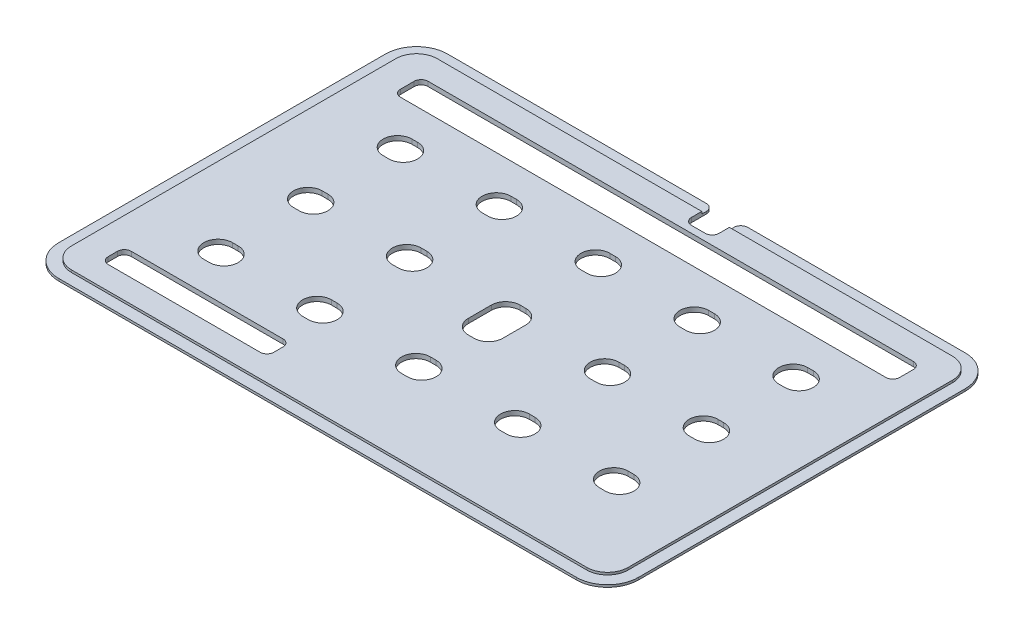
from build123d import *

# Parameters (mm, degrees)
SKETCH1_W                = 252
SKETCH1_H                = 169
OUTER_PROFILE_DEPTH      = 1
SKETCH2_W                = 242
SKETCH2_H                = 159
INNER_PROFILE_DEPTH      = 1
FILLET1_R                = 9
FILLET2_R                = 13.5
CUTOUT_DEPTH             = 152.724256465
CUTOUTS_COUNT            = 3
CUTOUTS_PITCH            = 43
CUTOUTS_COUNT_DIR2       = 3
CUTOUTS_PITCH_DIR2       = 39
MIRROR1_COPY_1_DEPTH     = 152.724256465
MIRROR1_COPY_2_DEPTH     = 152.724256465
MIRROR1_COPY_3_DEPTH     = 152.724256465
MIRROR1_COPY_4_DEPTH     = 152.724256465
MIRROR1_COPY_5_DEPTH     = 152.724256465
MIRROR1_COPY_6_DEPTH     = 152.724256465
MIRROR1_COPY_7_DEPTH     = 152.724256465
MIRROR1_COPY_8_DEPTH     = 152.724256465
MIRROR1_COPY_9_DEPTH     = 152.724256465
SKETCH4_W                = 217
SKETCH4_H                = 12
MESSAGE_WINDOW_DEPTH     = 152.724256465
MESSAGE_WINDOW_CORNERS_R = 3
SKETCH5_W                = 12
SKETCH5_H                = 12.5
CAMERA_CUTOUT_DEPTH      = 152.724256465
FILLET3_R                = 3
CUT_EXTRUDE1_DEPTH       = 152.724256465
CUT_EXTRUDE1_DEPTH_BACK  = 152.724256465
SKETCH7_W                = 72
SKETCH7_H                = 10
CUT_EXTRUDE2_DEPTH       = 10
FILLET5_R                = 3


with BuildPart() as part:
    # Sketch1 → Outer Profile (new body)
    with BuildSketch(Plane(origin=(0, 0, 0), x_dir=(1, 0, 0), z_dir=(0, 1, 0))):
        Rectangle(SKETCH1_W, SKETCH1_H)
    extrude(amount=OUTER_PROFILE_DEPTH)

    # Sketch2 → Inner Profile (add)
    with BuildSketch(Plane(origin=(0, 1, 0), x_dir=(1, 0, 0), z_dir=(0, 1, 0))):
        Rectangle(SKETCH2_W, SKETCH2_H)
    extrude(amount=INNER_PROFILE_DEPTH)

    # Fillet1
    fillet1_edges = [part.edges().sort_by_distance(p)[0] for p in [
        (121, 1.5, 79.5),
        (121, 1.5, -79.5),
        (-121, 1.5, -79.5),
        (-121, 1.5, 79.5),
    ]]
    fillet(fillet1_edges, radius=FILLET1_R)

    # Fillet2
    fillet2_edges = [part.edges().sort_by_distance(p)[0] for p in [
        (126, 0.5, 84.5),
        (-126, 0.5, 84.5),
        (-126, 0.5, -84.5),
        (126, 0.5, -84.5),
    ]]
    fillet(fillet2_edges, radius=FILLET2_R)

    # Sketch3 → Cutout (cut, through all)
    with BuildSketch(Plane(origin=(0, 2, 0), x_dir=(1, 0, 0), z_dir=(0, 1, 0))):
        with BuildLine():
            Line((-1.25, -34.25), (1.25, -34.25))
            ThreePointArc((1.25, -34.25), (7.5, -40.5), (1.25, -46.75))
            Line((1.25, -46.75), (-1.25, -46.75))
            ThreePointArc((-1.25, -46.75), (-7.5, -40.5), (-1.25, -34.25))
        make_face()
    cutout = extrude(amount=-CUTOUT_DEPTH, mode=Mode.SUBTRACT)

    # Cutouts: Cutout 3 × 3
    with Locations(*[(-i * CUTOUTS_PITCH, 0, -j * CUTOUTS_PITCH_DIR2) for i in range(CUTOUTS_COUNT) for j in range(CUTOUTS_COUNT_DIR2) if (i, j) != (0, 0)]):
        add(cutout, mode=Mode.SUBTRACT)

    # Mirror1 copy 1 sketch → Mirror1 copy 1 (cut, through all)
    with BuildSketch(Plane(origin=(0, 2, -39), x_dir=(-1, 0, 0), z_dir=(0, 1, 0))):
        with BuildLine():
            Line((-1.25, 34.25), (1.25, 34.25))
            ThreePointArc((1.25, 34.25), (7.5, 40.5), (1.25, 46.75))
            Line((1.25, 46.75), (-1.25, 46.75))
            ThreePointArc((-1.25, 46.75), (-7.5, 40.5), (-1.25, 34.25))
        make_face()
    extrude(amount=-MIRROR1_COPY_1_DEPTH, mode=Mode.SUBTRACT)

    # Mirror1 copy 2 sketch → Mirror1 copy 2 (cut, through all)
    with BuildSketch(Plane(origin=(0, 2, -78), x_dir=(-1, 0, 0), z_dir=(0, 1, 0))):
        with BuildLine():
            Line((-1.25, 34.25), (1.25, 34.25))
            ThreePointArc((1.25, 34.25), (7.5, 40.5), (1.25, 46.75))
            Line((1.25, 46.75), (-1.25, 46.75))
            ThreePointArc((-1.25, 46.75), (-7.5, 40.5), (-1.25, 34.25))
        make_face()
    extrude(amount=-MIRROR1_COPY_2_DEPTH, mode=Mode.SUBTRACT)

    # Mirror1 copy 3 sketch → Mirror1 copy 3 (cut, through all)
    with BuildSketch(Plane(origin=(43, 2, 0), x_dir=(-1, 0, 0), z_dir=(0, 1, 0))):
        with BuildLine():
            Line((-1.25, 34.25), (1.25, 34.25))
            ThreePointArc((1.25, 34.25), (7.5, 40.5), (1.25, 46.75))
            Line((1.25, 46.75), (-1.25, 46.75))
            ThreePointArc((-1.25, 46.75), (-7.5, 40.5), (-1.25, 34.25))
        make_face()
    extrude(amount=-MIRROR1_COPY_3_DEPTH, mode=Mode.SUBTRACT)

    # Mirror1 copy 4 sketch → Mirror1 copy 4 (cut, through all)
    with BuildSketch(Plane(origin=(43, 2, -39), x_dir=(-1, 0, 0), z_dir=(0, 1, 0))):
        with BuildLine():
            Line((-1.25, 34.25), (1.25, 34.25))
            ThreePointArc((1.25, 34.25), (7.5, 40.5), (1.25, 46.75))
            Line((1.25, 46.75), (-1.25, 46.75))
            ThreePointArc((-1.25, 46.75), (-7.5, 40.5), (-1.25, 34.25))
        make_face()
    extrude(amount=-MIRROR1_COPY_4_DEPTH, mode=Mode.SUBTRACT)

    # Mirror1 copy 5 sketch → Mirror1 copy 5 (cut, through all)
    with BuildSketch(Plane(origin=(43, 2, -78), x_dir=(-1, 0, 0), z_dir=(0, 1, 0))):
        with BuildLine():
            Line((-1.25, 34.25), (1.25, 34.25))
            ThreePointArc((1.25, 34.25), (7.5, 40.5), (1.25, 46.75))
            Line((1.25, 46.75), (-1.25, 46.75))
            ThreePointArc((-1.25, 46.75), (-7.5, 40.5), (-1.25, 34.25))
        make_face()
    extrude(amount=-MIRROR1_COPY_5_DEPTH, mode=Mode.SUBTRACT)

    # Mirror1 copy 6 sketch → Mirror1 copy 6 (cut, through all)
    with BuildSketch(Plane(origin=(86, 2, 0), x_dir=(-1, 0, 0), z_dir=(0, 1, 0))):
        with BuildLine():
            Line((-1.25, 34.25), (1.25, 34.25))
            ThreePointArc((1.25, 34.25), (7.5, 40.5), (1.25, 46.75))
            Line((1.25, 46.75), (-1.25, 46.75))
            ThreePointArc((-1.25, 46.75), (-7.5, 40.5), (-1.25, 34.25))
        make_face()
    extrude(amount=-MIRROR1_COPY_6_DEPTH, mode=Mode.SUBTRACT)

    # Mirror1 copy 7 sketch → Mirror1 copy 7 (cut, through all)
    with BuildSketch(Plane(origin=(86, 2, -39), x_dir=(-1, 0, 0), z_dir=(0, 1, 0))):
        with BuildLine():
            Line((-1.25, 34.25), (1.25, 34.25))
            ThreePointArc((1.25, 34.25), (7.5, 40.5), (1.25, 46.75))
            Line((1.25, 46.75), (-1.25, 46.75))
            ThreePointArc((-1.25, 46.75), (-7.5, 40.5), (-1.25, 34.25))
        make_face()
    extrude(amount=-MIRROR1_COPY_7_DEPTH, mode=Mode.SUBTRACT)

    # Mirror1 copy 8 sketch → Mirror1 copy 8 (cut, through all)
    with BuildSketch(Plane(origin=(86, 2, -78), x_dir=(-1, 0, 0), z_dir=(0, 1, 0))):
        with BuildLine():
            Line((-1.25, 34.25), (1.25, 34.25))
            ThreePointArc((1.25, 34.25), (7.5, 40.5), (1.25, 46.75))
            Line((1.25, 46.75), (-1.25, 46.75))
            ThreePointArc((-1.25, 46.75), (-7.5, 40.5), (-1.25, 34.25))
        make_face()
    extrude(amount=-MIRROR1_COPY_8_DEPTH, mode=Mode.SUBTRACT)

    # Mirror1 copy 9 sketch → Mirror1 copy 9 (cut, through all)
    with BuildSketch(Plane(origin=(0, 2, 0), x_dir=(-1, 0, 0), z_dir=(0, 1, 0))):
        with BuildLine():
            Line((-1.25, 34.25), (1.25, 34.25))
            ThreePointArc((1.25, 34.25), (7.5, 40.5), (1.25, 46.75))
            Line((1.25, 46.75), (-1.25, 46.75))
            ThreePointArc((-1.25, 46.75), (-7.5, 40.5), (-1.25, 34.25))
        make_face()
    extrude(amount=-MIRROR1_COPY_9_DEPTH, mode=Mode.SUBTRACT)

    # Sketch4 → Message Window (cut, through all)
    with BuildSketch(Plane(origin=(0, 2, 0), x_dir=(1, 0, 0), z_dir=(0, 1, 0))):
        with Locations((0, 63)):
            Rectangle(SKETCH4_W, SKETCH4_H)
    extrude(amount=-MESSAGE_WINDOW_DEPTH, mode=Mode.SUBTRACT)

    # Message Window Corners
    message_window_corners_edges = [part.edges().sort_by_distance(p)[0] for p in [
        (-108.5, 1, -57),
        (-108.5, 1, -69),
        (108.5, 1, -69),
        (108.5, 1, -57),
    ]]
    fillet(message_window_corners_edges, radius=MESSAGE_WINDOW_CORNERS_R)

    # Sketch5 → Camera Cutout (cut, through all)
    with BuildSketch(Plane(origin=(0, 2, 0), x_dir=(1, 0, 0), z_dir=(0, 1, 0))):
        with Locations((9, 78.25)):
            Rectangle(SKETCH5_W, SKETCH5_H)
    extrude(amount=-CAMERA_CUTOUT_DEPTH, mode=Mode.SUBTRACT)

    # Fillet3
    fillet3_edges = [part.edges().sort_by_distance(p)[0] for p in [
        (3, 0.5, -84.5),
        (3, 1, -72),
        (15, 0.5, -84.5),
        (15, 1, -72),
    ]]
    fillet(fillet3_edges, radius=FILLET3_R)

    # Sketch6 → Cut-Extrude1 (cut, two sides: drawn at the far end of the back side and taken through both)
    with BuildSketch(Plane(origin=(0, 2, 0), x_dir=(1, 0, 0), z_dir=(0, 1, 0)).offset(-CUT_EXTRUDE1_DEPTH_BACK)):
        with BuildLine():
            ThreePointArc((-1.25, -7.75), (-5.669417382, -5.919417382), (-7.5, -1.5))
            Line((-7.5, -1.5), (-7.5, -11.5))
            ThreePointArc((-7.5, -11.5), (-5.669417382, -15.919417382), (-1.25, -17.75))
            Line((-1.25, -17.75), (1.25, -17.75))
            ThreePointArc((1.25, -17.75), (5.669417382, -15.919417382), (7.5, -11.5))
            Line((7.5, -11.5), (7.5, -1.5))
            ThreePointArc((7.5, -1.5), (5.669417382, -5.919417382), (1.25, -7.75))
            Line((1.25, -7.75), (-1.25, -7.75))
        make_face()
    extrude(amount=CUT_EXTRUDE1_DEPTH + CUT_EXTRUDE1_DEPTH_BACK, mode=Mode.SUBTRACT)

    # Sketch7 → Cut-Extrude2 (cut)
    with BuildSketch(Plane(origin=(0, 2, 0), x_dir=(1, 0, 0), z_dir=(0, 1, 0))):
        with Locations((-73, -64.5)):
            Rectangle(SKETCH7_W, SKETCH7_H)
    extrude(amount=-CUT_EXTRUDE2_DEPTH, mode=Mode.SUBTRACT)

    # Fillet5
    fillet5_edges = [part.edges().sort_by_distance(p)[0] for p in [
        (-109, 1, 69.5),
        (-109, 1, 59.5),
        (-37, 1, 59.5),
        (-37, 1, 69.5),
    ]]
    fillet(fillet5_edges, radius=FILLET5_R)


solid = part.part
